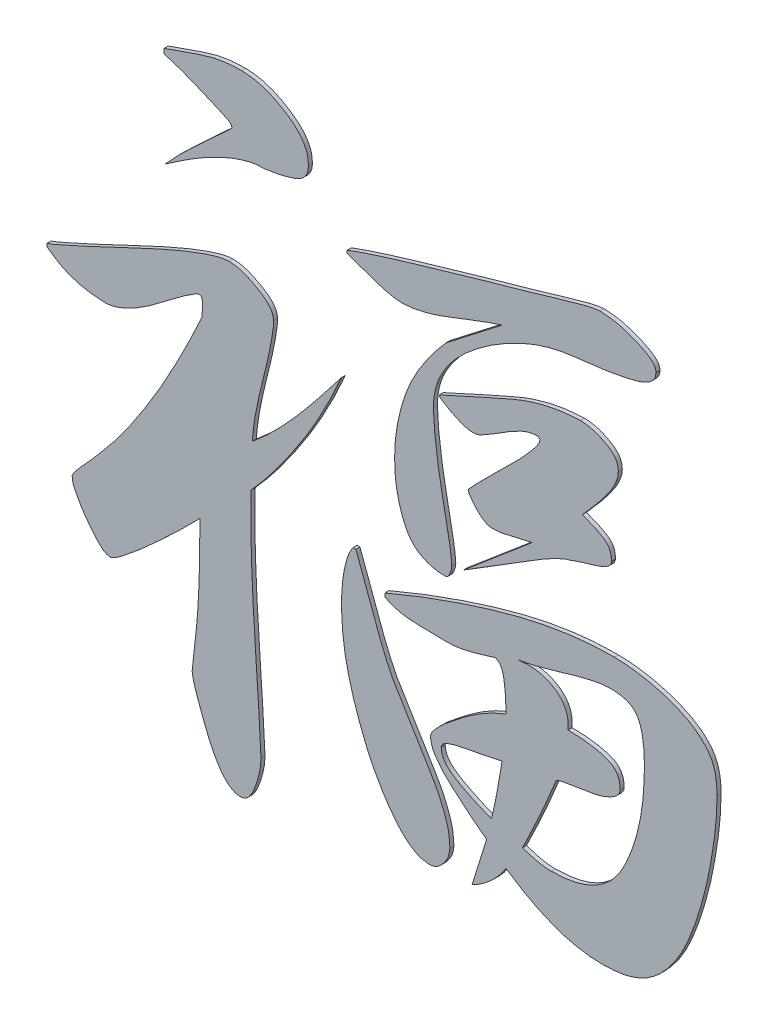
from build123d import *

# Parameters (mm, degrees)
EXTRUDE_1_DEPTH   = 0.2
EXTRUDE_1_2_DEPTH = 0.2
EXTRUDE_1_3_DEPTH = 0.2
EXTRUDE_1_4_DEPTH = 0.2
EXTRUDE_1_5_DEPTH = 0.2
EXTRUDE_1_6_DEPTH = 0.2


with BuildPart() as part:
    # 草图1 → 凸台-拉伸1 (new body)
    with BuildSketch(Plane.XY):
        with BuildLine():
            add(Edge.make_bspline(
                [(11.330654164, 14.322393391), (11.324253861, 14.134498164), (11.310569021, 13.732749056), (11.306668839, 13.094424337), (11.312968434, 12.383659133), (11.327935575, 11.602029184), (11.366081557, 10.75016704), (11.401169595, 9.825114969), (11.459538592, 8.829892344), (11.525426569, 7.795604838), (11.589514472, 6.788982369), (11.652013891, 5.875657707), (11.703295055, 5.086847596), (11.740115676, 4.424244202), (11.775149816, 3.888623471), (11.798802316, 3.479340829), (11.809329113, 3.19455556), (11.814411476, 3.045695139), (11.816253628, 2.991739228)],
                knots=[0, 0, 0, 0, 0.79538843, 1.700663702, 2.700395676, 3.802681245, 5.007971143, 6.307963553, 7.719187998, 9.225639709, 10.692812639, 11.986665706, 13.098828659, 14.037175588, 14.79432957, 15.369822845, 15.771586145, 16, 16, 16, 16], degree=3))
            add(Edge.make_bspline(
                [(11.816253628, 2.991739228), (11.813022279, 2.891044144), (11.80615662, 2.677096978), (11.74524648, 2.345146739), (11.655592594, 1.984804986), (11.534739538, 1.619335745), (11.390447911, 1.286989233), (11.22515831, 1.026689732), (11.025312642, 0.855319883), (10.871556898, 0.831512991), (10.800401875, 0.820495646)],
                knots=[0, 0, 0, 0, 0.946381514, 2.010779821, 3.165157064, 4.437872024, 5.628291403, 6.560163754, 7.333673149, 8, 8, 8, 8], degree=3))
            add(Edge.make_bspline(
                [(10.800401875, 0.820495646), (10.728754998, 0.825742305), (10.580033601, 0.836633086), (10.364558586, 0.936598595), (10.149332792, 1.083115432), (9.942504302, 1.295694337), (9.744093555, 1.567415416), (9.543999762, 1.892890176), (9.341565875, 2.273765443), (9.157420122, 2.700236963), (8.984933788, 3.133720454), (8.831834058, 3.538640192), (8.691683362, 3.896839702), (8.591774428, 4.216423073), (8.494347312, 4.486114912), (8.443675858, 4.719744647), (8.397549873, 4.904514056), (8.391631709, 5.015825089), (8.389149364, 5.062513954)],
                knots=[0, 0, 0, 0, 0.669575808, 1.389875645, 2.194247352, 3.108372334, 4.156562561, 5.349126888, 6.693282995, 8.202782061, 9.708029294, 11.073920326, 12.268019157, 13.317664194, 14.218166094, 14.955426338, 15.561858714, 16, 16, 16, 16], degree=3))
            add(Edge.make_bspline(
                [(8.389149364, 5.062513954), (8.391204608, 5.082965116), (8.396614331, 5.136795772), (8.399250414, 5.241517896), (8.419941206, 5.391750133), (8.441693492, 5.588799438), (8.461501645, 5.833187261), (8.497611136, 6.121101632), (8.535515119, 6.45612431), (8.581884144, 6.837127273), (8.627598774, 7.270431545), (8.665101539, 7.758132803), (8.698605323, 8.301468126), (8.726156746, 8.898781656), (8.747573021, 9.550027356), (8.766416066, 10.257021743), (8.76802901, 11.018095151), (8.772152608, 11.544619551), (8.774279973, 11.816253628)],
                knots=[0, 0, 0, 0, 0.145696367, 0.38349562, 0.74183702, 1.219625554, 1.789275715, 2.47974456, 3.276556324, 4.179711983, 5.200865282, 6.365316083, 7.647262247, 9.060210408, 10.604427396, 12.266930311, 14.074108358, 16, 16, 16, 16], degree=3))
            add(Edge.make_bspline(
                [(8.774279973, 11.816253628), (8.587384844, 11.623597074), (8.198011069, 11.222220054), (7.568863436, 10.615831203), (6.885188185, 9.964899407), (6.272881828, 9.422780712), (5.794741511, 8.984267428), (5.456290527, 8.709997517), (5.16889581, 8.465834856), (4.914882571, 8.272569691), (4.708144867, 8.110917794), (4.532097407, 8.009790395), (4.404485951, 7.929611434), (4.324453244, 7.915007341), (4.292252735, 7.909131503)],
                knots=[0, 0, 0, 0, 1.618357131, 3.371654625, 5.26839297, 7.309714225, 8.302860571, 9.17906056, 9.936045346, 10.57560345, 11.105139972, 11.513040299, 11.804075726, 12, 12, 12, 12], degree=3))
            add(Edge.make_bspline(
                [(4.292252735, 7.909131503), (4.21750946, 7.926826289), (4.037987812, 7.969326398), (3.780627672, 8.192020626), (3.477207831, 8.515302639), (3.153512772, 8.943504377), (2.841046788, 9.389899022), (2.613866689, 9.809147294), (2.445665143, 10.15187044), (2.421593681, 10.371256723), (2.411252512, 10.465505693)],
                knots=[0, 0, 0, 0, 0.555032031, 1.333100069, 2.420344952, 3.816151121, 5.246006348, 6.3967443, 7.311236795, 8, 8, 8, 8], degree=3))
            add(Edge.make_bspline(
                [(2.411252512, 10.465505693), (2.422861432, 10.501555033), (2.455937479, 10.604266536), (2.587466636, 10.771148642), (2.784109915, 11.006738645), (3.051696585, 11.30598946), (3.379438, 11.650756414), (3.721391683, 12.057916548), (4.097903504, 12.496950445), (4.501954485, 12.990769036), (4.939136298, 13.5635118), (5.410315847, 14.238651026), (5.92522693, 15.024504684), (6.48003817, 15.918424678), (7.067156643, 16.919994462), (7.660568175, 18.034433655), (8.277676092, 19.248397684), (8.671180457, 20.103511692), (8.874748828, 20.545880777)],
                knots=[0, 0, 0, 0, 0.150259248, 0.428117494, 0.833824251, 1.380448858, 2.026397406, 2.731488223, 3.500174529, 4.333484975, 5.275952657, 6.373274326, 7.616425856, 9.022873249, 10.569263833, 12.245932144, 14.057939003, 16, 16, 16, 16], degree=3))
            add(Edge.make_bspline(
                [(8.874748828, 20.545880777), (8.886341622, 20.684976653), (8.905907402, 20.919736209), (8.905901753, 21.196401959), (8.877017537, 21.416733513), (8.774216995, 21.447792016), (8.729627149, 21.461263675)],
                knots=[0, 0, 0, 0, 1.659233457, 2.800377112, 3.479662284, 4, 4, 4, 4], degree=3))
            add(Edge.make_bspline(
                [(8.729627149, 21.461263675), (8.708853429, 21.458495574), (8.646532268, 21.45019127), (8.536187121, 21.380656481), (8.371554794, 21.285949383), (8.155724164, 21.141135723), (7.890235607, 20.952692748), (7.573690503, 20.715232724), (7.196872633, 20.446830091), (6.797173521, 20.129571937), (6.382958057, 19.814491232), (5.975667853, 19.533920296), (5.592334809, 19.301658652), (5.236504109, 19.105558379), (4.904528943, 18.958930224), (4.60198011, 18.839423202), (4.319051452, 18.77626234), (4.138068098, 18.765073619), (4.052243804, 18.759767805)],
                knots=[0, 0, 0, 0, 0.182638434, 0.547915302, 1.119430622, 1.862479552, 2.823372968, 3.97998051, 5.3359402, 6.884731349, 8.459494111, 9.904901646, 11.224456431, 12.393913014, 13.468721188, 14.409406643, 15.245723168, 16, 16, 16, 16], degree=3))
            add(Edge.make_bspline(
                [(4.052243804, 18.759767805), (3.807697068, 18.771587599), (3.309773672, 18.795653968), (2.564336666, 18.961409445), (1.819614773, 19.249562009), (1.380238558, 19.564313801), (1.155391829, 19.725385131)],
                knots=[0, 0, 0, 0, 0.943604929, 1.921280884, 2.936234645, 4, 4, 4, 4], degree=3))
            Line((1.155391829, 19.725385131), (1.155391829, 19.87050681))
            add(Edge.make_bspline(
                [(1.155391829, 19.87050681), (1.220684659, 19.89424472), (1.386330399, 19.95446701), (1.679777848, 20.07904119), (2.07306945, 20.254644734), (2.565865269, 20.476622664), (3.161418887, 20.743832118), (3.848987368, 21.069679486), (4.641804494, 21.437334824), (5.497908559, 21.848408264), (6.363909556, 22.252620319), (7.17311202, 22.615951141), (7.894136469, 22.925544195), (8.52883833, 23.176669845), (9.075538102, 23.374681138), (9.534890665, 23.51600964), (9.907458022, 23.609155821), (10.130270536, 23.625515438), (10.225496763, 23.632507256)],
                knots=[0, 0, 0, 0, 0.338665448, 0.85918299, 1.553608017, 2.43868447, 3.494161622, 4.735883398, 6.148027237, 7.75474018, 9.365799953, 10.807152419, 12.07918291, 13.190886292, 14.134803017, 14.912398318, 15.535177797, 16, 16, 16, 16], degree=3))
            add(Edge.make_bspline(
                [(10.225496763, 23.632507256), (10.333961837, 23.627012873), (10.561728455, 23.615475176), (10.908403298, 23.518100147), (11.27424607, 23.370388429), (11.642396654, 23.176307299), (11.982138802, 22.96101868), (12.237800272, 22.716593056), (12.409445864, 22.458616357), (12.431076405, 22.270847489), (12.441393168, 22.181290467)],
                knots=[0, 0, 0, 0, 0.917402559, 1.926460469, 3.029691615, 4.256150376, 5.449355566, 6.418876308, 7.245877491, 8, 8, 8, 8], degree=3))
            add(Edge.make_bspline(
                [(12.441393168, 22.181290467), (12.440899248, 22.114215975), (12.439811623, 21.966516025), (12.405495463, 21.727052624), (12.36923276, 21.447348577), (12.311390974, 21.12743815), (12.237393674, 20.767171484), (12.157072076, 20.36365987), (12.046800815, 19.924480514), (11.896736199, 19.305255561), (11.714914113, 18.563819166), (11.544558526, 17.749254767), (11.434429612, 17.0559736), (11.397495576, 16.633405609), (11.380888591, 16.443402545)],
                knots=[0, 0, 0, 0, 0.412783449, 0.908960966, 1.487639277, 2.150939069, 2.910709372, 3.75367677, 4.684977723, 5.699653309, 7.679060907, 9.387443828, 10.825292763, 12, 12, 12, 12], degree=3))
            add(Edge.make_bspline(
                [(11.380888591, 16.443402545), (11.559170681, 16.594245658), (11.925368452, 16.904082792), (12.457722836, 17.413106913), (12.996155702, 17.967642602), (13.535320899, 18.572869184), (14.088728205, 19.219930904), (14.64988278, 19.914008483), (15.232970915, 20.645103052), (15.620096398, 21.151704036), (15.818263005, 21.411029248)],
                knots=[0, 0, 0, 0, 0.839469166, 1.724299603, 2.64676325, 3.617812911, 4.637941935, 5.707743082, 6.826611019, 8, 8, 8, 8], degree=3))
            add(Edge.make_bspline(
                [(15.818263005, 21.411029248), (15.670984658, 21.076367339), (15.376534832, 20.407286358), (14.873927068, 19.434215585), (14.348823846, 18.475575296), (13.772174323, 17.558395239), (13.184707087, 16.672468917), (12.582608281, 15.835657118), (11.970718743, 15.051159371), (11.541367867, 14.562308211), (11.330654164, 14.322393391)],
                knots=[0, 0, 0, 0, 1.041371311, 2.081986987, 3.118816234, 4.154276263, 5.167133537, 6.146815387, 7.090507525, 8, 8, 8, 8], degree=3))
        make_face()
    extrude(amount=EXTRUDE_1_DEPTH)


with BuildPart() as body_2:
    # 草图1 → Extrude 1 2 (new body)
    with BuildSketch(Plane.XY):
        with BuildLine():
            add(Edge.make_bspline(
                [(21.316141996, 16.058271936), (21.312308921, 15.992062594), (21.304069452, 15.849740873), (21.21993503, 15.666069905), (21.152112354, 15.492773477), (21.059970192, 15.449232582), (21.025898638, 15.433132396)],
                knots=[0, 0, 0, 0, 1.091800076, 2.346902458, 3.38873148, 4, 4, 4, 4], degree=3))
            add(Edge.make_bspline(
                [(21.025898638, 15.433132396), (20.910289326, 15.43569022), (20.685061919, 15.440673316), (20.362733523, 15.497817408), (20.067504412, 15.586342534), (19.801881974, 15.712200845), (19.55762366, 15.865583171), (19.351286046, 16.068510505), (19.16178339, 16.296322967), (18.965657869, 16.663985185), (18.766122079, 17.169449432), (18.594530329, 17.827412598), (18.485507279, 18.540320818), (18.474967401, 19.03471001), (18.469524447, 19.290020094)],
                knots=[0, 0, 0, 0, 0.793196158, 1.545286547, 2.240514064, 2.903644977, 3.559347005, 4.210174787, 4.88271922, 5.586467429, 7.060049272, 8.606727277, 10.247662454, 12, 12, 12, 12], degree=3))
            add(Edge.make_bspline(
                [(18.469524447, 19.290020094), (18.475481249, 19.541586362), (18.487447626, 20.046947651), (18.601251807, 20.806557553), (18.773453275, 21.569971722), (19.014533673, 22.346318495), (19.349021055, 23.132377696), (19.806600355, 23.920699991), (20.357427394, 24.731068053), (20.797334844, 25.245975666), (21.025898638, 25.513507479)],
                knots=[0, 0, 0, 0, 0.876292567, 1.760348648, 2.671206051, 3.602335618, 4.590048782, 5.6413031, 6.774486057, 8, 8, 8, 8], degree=3))
            Line((21.025898638, 25.513507479), (23.822281759, 27.679169457))
            add(Edge.make_bspline(
                [(23.822281759, 27.679169457), (23.771963157, 27.664556438), (23.657790655, 27.631399615), (23.468384933, 27.568730516), (23.238267127, 27.492175362), (22.973093792, 27.387861098), (22.663208696, 27.28029317), (22.321608306, 27.143159098), (21.936313484, 26.9995489), (21.397156736, 26.782506998), (20.745752107, 26.534662941), (20.023296326, 26.313550384), (19.405031364, 26.174056787), (19.024476874, 26.14957291), (18.854655057, 26.138647019)],
                knots=[0, 0, 0, 0, 0.361274893, 0.819729812, 1.37554873, 2.033227569, 2.784040037, 3.63696794, 4.570951266, 5.619187945, 7.644787611, 9.373739958, 10.828035765, 12, 12, 12, 12], degree=3))
            add(Edge.make_bspline(
                [(18.854655057, 26.138647019), (18.750205853, 26.143758828), (18.520955584, 26.154978476), (18.153405081, 26.22815796), (17.734121735, 26.340403741), (17.291624732, 26.492066769), (16.875192332, 26.645106442), (16.531631703, 26.769676913), (16.288219772, 26.854640639), (16.156961265, 26.894276435), (16.108506363, 26.908908238)],
                knots=[0, 0, 0, 0, 0.875487053, 1.921562192, 3.131979567, 4.512728305, 5.839682395, 6.850888363, 7.575798223, 8, 8, 8, 8], degree=3))
            Line((16.108506363, 26.908908238), (16.108506363, 27.054029917))
            add(Edge.make_bspline(
                [(16.108506363, 27.054029917), (16.190264219, 27.085931089), (16.378937857, 27.159549827), (16.703681995, 27.277722663), (17.109586957, 27.407220242), (17.592471773, 27.566088767), (18.155470953, 27.745393458), (18.80110883, 27.936429506), (19.523006518, 28.158449505), (20.300435518, 28.381968918), (21.078225499, 28.608636075), (21.80080293, 28.822909878), (22.44536808, 29.001630987), (23.00150596, 29.17685579), (23.484886277, 29.304727837), (23.882918711, 29.425147053), (24.20372263, 29.513550315), (24.538264688, 29.607836729), (24.945845389, 29.716200691), (25.477814984, 29.877652573), (26.101824341, 30.05935893), (26.778065311, 30.261659953), (27.427997372, 30.452788105), (27.975662882, 30.600467165), (28.38145136, 30.693383664), (28.607352146, 30.713382019), (28.69502121, 30.721143112)],
                knots=[0, 0, 0, 0, 0.481687843, 1.111597125, 1.89630973, 2.819895706, 3.901812476, 5.139122402, 6.515325444, 8.04708972, 9.578853997, 10.961935262, 12.183681989, 13.249821225, 14.161589177, 14.927471315, 15.532038665, 15.98792264, 16.835191234, 17.846568169, 19.03889796, 20.402388065, 21.720931766, 22.756305719, 23.51733894, 24, 24, 24, 24], degree=3))
            add(Edge.make_bspline(
                [(28.69502121, 30.721143112), (28.842195097, 30.714478584), (29.141894709, 30.700907179), (29.598570557, 30.629650942), (30.060903061, 30.488641423), (30.517341209, 30.319358901), (30.924298251, 30.126850711), (31.234338408, 29.925227271), (31.444895985, 29.70854012), (31.476987553, 29.540688084), (31.491404331, 29.465282429)],
                knots=[0, 0, 0, 0, 1.094463164, 2.228725434, 3.423320894, 4.679080779, 5.847791615, 6.752859942, 7.439736242, 8, 8, 8, 8], degree=3))
            add(Edge.make_bspline(
                [(31.491404331, 29.465282429), (31.477610228, 29.37045991), (31.44886711, 29.172875864), (31.215873606, 28.923101163), (30.869514837, 28.7300485), (30.397432482, 28.575071265), (29.811688802, 28.45194638), (29.118521191, 28.319087366), (28.314621053, 28.213902742), (27.742516587, 28.148966612), (27.439160527, 28.114534494)],
                knots=[0, 0, 0, 0, 0.500525511, 1.042957486, 1.737186929, 2.60949938, 3.678135963, 4.929400572, 6.371827178, 8, 8, 8, 8], degree=3))
            add(Edge.make_bspline(
                [(27.439160527, 28.114534494), (27.241400647, 28.089852387), (26.845080149, 28.040388234), (26.254663285, 27.906586306), (25.663446959, 27.737161366), (25.075940034, 27.509631828), (24.488688423, 27.241482075), (23.902075623, 26.927391277), (23.314019573, 26.569357734), (22.739010951, 26.169798208), (22.200087538, 25.743139634), (21.72088373, 25.301977506), (21.315331476, 24.848819511), (20.983946263, 24.384489047), (20.72232642, 23.911655013), (20.534268906, 23.42812493), (20.426090774, 22.930252155), (20.409210606, 22.594822722), (20.400759098, 22.426881)],
                knots=[0, 0, 0, 0, 0.983104393, 1.970189414, 2.984369065, 4.016189379, 5.076387827, 6.169174378, 7.298394575, 8.472752213, 9.622949055, 10.688582114, 11.68379248, 12.618934901, 13.498403633, 14.344294437, 15.171026707, 16, 16, 16, 16], degree=3))
            add(Edge.make_bspline(
                [(20.400759098, 22.426881), (20.411922584, 22.149364076), (20.435206326, 21.570545569), (20.547627065, 20.670861393), (20.679031112, 19.698945891), (20.845904182, 18.863289741), (20.97828682, 18.196181551), (21.067104967, 17.738389137), (21.146973395, 17.331587593), (21.208418647, 16.976149668), (21.253179715, 16.672521204), (21.285897451, 16.421317711), (21.312316393, 16.222539193), (21.3150142, 16.106698257), (21.316141996, 16.058271936)],
                knots=[0, 0, 0, 0, 1.551523487, 3.236020687, 5.063840041, 7.031798186, 7.99634307, 8.865052861, 9.637934777, 10.31316023, 10.880776894, 11.352824719, 11.729453862, 12, 12, 12, 12], degree=3))
        make_face()
    extrude(amount=EXTRUDE_1_2_DEPTH)


with BuildPart() as body_3:
    # 草图1 → Extrude 1 3 (new body)
    with BuildSketch(Plane.XY):
        with BuildLine():
            Line((16.398749721, 14.372627819), (16.5438714, 14.372627819))
            add(Edge.make_bspline(
                [(16.5438714, 14.372627819), (16.657295446, 14.060034165), (16.872107495, 13.468017874), (17.176720502, 12.631748506), (17.453875024, 11.900742287), (17.686563914, 11.260983533), (17.907737271, 10.701639358), (18.124370739, 10.208699691), (18.333343584, 9.767163851), (18.636724076, 9.251386365), (19.040585631, 8.607948767), (19.445906993, 7.947232803), (19.774558829, 7.407269101), (20.003268524, 7.027647944), (20.2092083, 6.684154992), (20.44871288, 6.272216056), (20.728917358, 5.772576852), (20.982730041, 5.141856689), (21.187938343, 4.488691301), (21.210181797, 4.03706008), (21.221254744, 3.812234874)],
                knots=[0, 0, 0, 0, 1.543544745, 2.923295538, 4.131177246, 5.17228436, 6.083178246, 6.922347909, 7.6716511, 8.348635593, 9.697997211, 11.198419017, 11.946377273, 12.632118598, 13.255654752, 13.80518508, 14.844571472, 15.909476775, 16.9593228, 18, 18, 18, 18], degree=3))
            add(Edge.make_bspline(
                [(21.221254744, 3.812234874), (21.204596504, 3.677038467), (21.168633783, 3.385169056), (20.95516126, 3.067918193), (20.753338126, 2.838000864), (20.584256164, 2.701767296), (20.397330291, 2.625401335), (20.269270872, 2.612862293), (20.205402992, 2.606608618)],
                knots=[0, 0, 0, 0, 1.41839124, 3.062100729, 3.908536818, 4.64945605, 5.326434705, 6, 6, 6, 6], degree=3))
            add(Edge.make_bspline(
                [(20.205402992, 2.606608618), (20.057698264, 2.621655783), (19.747101523, 2.653297292), (19.301811821, 2.899663216), (18.854523784, 3.265486044), (18.427569795, 3.772565565), (18.006326853, 4.358006125), (17.616024933, 5.003776402), (17.258540913, 5.689197794), (16.945326605, 6.409341357), (16.674762766, 7.135052965), (16.428861783, 7.840103976), (16.235841493, 8.521305032), (16.024725288, 9.3889351), (15.859277532, 10.46860985), (15.831927893, 11.333758849), (15.818263005, 11.766019201)],
                knots=[0, 0, 0, 0, 0.575801795, 1.210808644, 1.951139853, 2.833420229, 3.793326207, 4.773646082, 5.783275449, 6.816882703, 7.844702708, 8.814144911, 9.738338796, 10.614346814, 12.308402783, 14, 14, 14, 14], degree=3))
            add(Edge.make_bspline(
                [(15.818263005, 11.766019201), (15.82757853, 11.998844452), (15.846964405, 12.483360499), (15.931826616, 13.08771556), (16.039464078, 13.563133018), (16.136874937, 13.87987683), (16.25296633, 14.14945203), (16.352086322, 14.301192104), (16.398749721, 14.372627819)],
                knots=[0, 0, 0, 0, 1.551084558, 3.227851587, 4.054318665, 4.794881752, 5.432658218, 6, 6, 6, 6], degree=3))
        make_face()
    extrude(amount=EXTRUDE_1_3_DEPTH)


with BuildPart() as body_4:
    # 草图1 → Extrude 1 4 (new body)
    with BuildSketch(Plane.XY):
        with BuildLine():
            add(Edge.make_bspline(
                [(29.269926323, 20.205402992), (29.256298068, 20.148446777), (29.2241113, 20.013929452), (29.017398813, 19.863013501), (28.728375513, 19.721098037), (28.353056352, 19.599116328), (27.971730331, 19.492018775), (27.65147581, 19.386514586), (27.416578455, 19.317070541), (27.295560184, 19.26112972), (27.249386024, 19.239785666)],
                knots=[0, 0, 0, 0, 0.592093551, 1.398387193, 2.503314584, 3.974428174, 5.464539272, 6.618290104, 7.472812708, 8, 8, 8, 8], degree=3))
            add(Edge.make_bspline(
                [(27.249386024, 19.239785666), (27.193194296, 19.228103923), (27.06313374, 19.20106553), (26.85273593, 19.1186064), (26.600549103, 18.997123294), (26.301334424, 18.849050607), (25.958962679, 18.66265294), (25.573893184, 18.438977343), (25.145986772, 18.175306694), (24.685610344, 17.890069792), (24.226631586, 17.592995295), (23.782414327, 17.323932537), (23.383297683, 17.063574268), (23.015839994, 16.836153962), (22.682361265, 16.635244697), (22.39076284, 16.450933078), (22.13149823, 16.293824748), (21.971085629, 16.197752134), (21.896628712, 16.153159187)],
                knots=[0, 0, 0, 0, 0.444176918, 1.028085426, 1.744095967, 2.614601722, 3.614591171, 4.7645587, 6.065272424, 7.509580795, 8.961569611, 10.301956005, 11.533881122, 12.654178883, 13.650732111, 14.550942037, 15.327407027, 16, 16, 16, 16], degree=3))
            Line((21.896628712, 16.153159187), (25.318151373, 19.050011163))
            add(Edge.make_bspline(
                [(25.318151373, 19.050011163), (25.109502643, 19.004441408), (24.72136804, 18.919671188), (24.190525437, 18.789398439), (23.742595319, 18.68346251), (23.467378873, 18.670687944), (23.342263898, 18.664880554)],
                knots=[0, 0, 0, 0, 1.27061078, 2.363628136, 3.256095966, 4, 4, 4, 4], degree=3))
            add(Edge.make_bspline(
                [(23.342263898, 18.664880554), (23.276071359, 18.670099331), (23.13782922, 18.68099867), (22.939921835, 18.783526833), (22.734299798, 18.924237675), (22.542846384, 19.116987977), (22.379508975, 19.317603587), (22.24441427, 19.482890693), (22.166930896, 19.6160603), (22.144986883, 19.695253692), (22.136637642, 19.725385131)],
                knots=[0, 0, 0, 0, 0.940205355, 1.963604955, 3.129156264, 4.501984871, 5.823098861, 6.828371421, 7.554219698, 8, 8, 8, 8], degree=3))
            add(Edge.make_bspline(
                [(22.136637642, 19.725385131), (22.145478574, 19.742441532), (22.174439659, 19.798314814), (22.266080729, 19.89417289), (22.405128094, 20.046278804), (22.598027352, 20.251974994), (22.853548914, 20.500606135), (23.152358724, 20.812067836), (23.516427193, 21.166197284), (23.918575131, 21.556564969), (24.319873465, 21.951625819), (24.684576326, 22.320079902), (24.993298572, 22.648276398), (25.241018817, 22.937764651), (25.442546291, 23.177599947), (25.582159967, 23.378520344), (25.676801951, 23.53776549), (25.695743111, 23.637474404), (25.703281983, 23.67716008)],
                knots=[0, 0, 0, 0, 0.171775479, 0.562701345, 1.176629522, 2.026383528, 3.088166475, 4.374157717, 5.896092335, 7.642294824, 9.40017507, 10.945704166, 12.29145688, 13.438798879, 14.363838141, 15.095098308, 15.63983526, 16, 16, 16, 16], degree=3))
            add(Edge.make_bspline(
                [(25.703281983, 23.67716008), (25.701888663, 23.693642231), (25.699041852, 23.727318316), (25.65334726, 23.746831284), (25.628102627, 23.768263437), (25.612166647, 23.775836462), (25.608394731, 23.777628935)],
                knots=[0, 0, 0, 0, 1.254381369, 2.562933408, 3.659858094, 4, 4, 4, 4], degree=3))
            add(Edge.make_bspline(
                [(25.608394731, 23.777628935), (25.499774766, 23.772752256), (25.250683116, 23.761568862), (24.846204898, 23.623836329), (24.377653544, 23.385458188), (23.869791239, 23.083115924), (23.396830472, 22.764188384), (22.992660397, 22.546062334), (22.728156415, 22.377118197), (22.574622265, 22.339397475), (22.521768252, 22.326412146)],
                knots=[0, 0, 0, 0, 0.754123942, 1.729387206, 2.940230979, 4.415405646, 5.842121033, 6.904198509, 7.622771175, 8, 8, 8, 8], degree=3))
            add(Edge.make_bspline(
                [(22.521768252, 22.326412146), (22.405660922, 22.322029884), (22.145520512, 22.312211354), (21.726895059, 22.453888409), (21.245010812, 22.678667644), (20.915693064, 22.887576039), (20.73565528, 23.001786113)],
                knots=[0, 0, 0, 0, 0.712394433, 1.596131619, 2.685806822, 4, 4, 4, 4], degree=3))
            Line((20.73565528, 23.001786113), (20.691002456, 23.102254968))
            add(Edge.make_bspline(
                [(20.691002456, 23.102254968), (21.014561716, 23.251474132), (21.645877727, 23.542624655), (22.575850076, 23.963852962), (23.467541458, 24.354833332), (24.31690498, 24.74183248), (25.157134543, 25.066125451), (26.003750345, 25.30957663), (26.862664668, 25.463924217), (27.440429018, 25.49697619), (27.729403885, 25.513507479)],
                knots=[0, 0, 0, 0, 1.140686552, 2.22566241, 3.268284224, 4.257690817, 5.213465501, 6.148620934, 7.074013446, 8, 8, 8, 8], degree=3))
            add(Edge.make_bspline(
                [(27.729403885, 25.513507479), (27.828298091, 25.508628275), (28.029730104, 25.4986901), (28.335689881, 25.434000293), (28.648476118, 25.326970482), (28.956321617, 25.180650018), (29.238059111, 25.007499302), (29.455879342, 24.792071337), (29.589851885, 24.534968582), (29.603539314, 24.350277015), (29.610404108, 24.257646796)],
                knots=[0, 0, 0, 0, 0.959961295, 1.955290833, 3.023342624, 4.162482058, 5.25961102, 6.217531289, 7.106020544, 8, 8, 8, 8], degree=3))
            add(Edge.make_bspline(
                [(29.610404108, 24.257646796), (29.602915921, 24.17127326), (29.586545269, 23.9824437), (29.473321034, 23.691421985), (29.311859774, 23.363480972), (28.983184131, 22.883724402), (28.493610329, 22.249471577), (28.052843793, 21.75981851), (27.824291136, 21.505916499)],
                knots=[0, 0, 0, 0, 0.466413254, 1.019671231, 1.671648944, 2.441308307, 4.154695566, 6, 6, 6, 6], degree=3))
            add(Edge.make_bspline(
                [(27.824291136, 21.505916499), (27.945654107, 21.460558887), (28.169996974, 21.376714064), (28.47708697, 21.243111694), (28.724301936, 21.108213526), (28.932117168, 20.988587716), (29.08729293, 20.841306878), (29.197984565, 20.661677924), (29.257250855, 20.44339743), (29.265548528, 20.287600411), (29.269926323, 20.205402992)],
                knots=[0, 0, 0, 0, 1.476851904, 2.7300023, 3.811526531, 4.688198478, 5.453098593, 6.224147286, 7.063072503, 8, 8, 8, 8], degree=3))
        make_face()
    extrude(amount=EXTRUDE_1_4_DEPTH)


with BuildPart() as body_5:
    # 草图1 → Extrude 1 5 (new body)
    with BuildSketch(Plane.XY):
        with BuildLine():
            add(Edge.make_bspline(
                [(14.177271712, 29.755525787), (14.172972811, 29.657256747), (14.164779184, 29.469957751), (14.042322052, 29.218088513), (13.856098237, 29.010124289), (13.586255247, 28.871027569), (13.261224434, 28.765678448), (12.884158346, 28.657397835), (12.443307054, 28.570281242), (12.129050462, 28.524234085), (11.961375307, 28.499665104)],
                knots=[0, 0, 0, 0, 0.834599689, 1.590731771, 2.346863853, 3.189345879, 4.152486875, 5.278220189, 6.54776363, 8, 8, 8, 8], degree=3))
            add(Edge.make_bspline(
                [(11.961375307, 28.499665104), (11.836354208, 28.500039272), (11.561353246, 28.500862307), (11.11574751, 28.404007968), (10.603187255, 28.246092238), (10.019720552, 28.015062529), (9.37208361, 27.696037729), (8.648376617, 27.301412671), (7.865797385, 26.798069818), (7.3239784, 26.428384573), (7.038401429, 26.233534271)],
                knots=[0, 0, 0, 0, 0.544945338, 1.19868161, 1.98050497, 2.889345355, 3.936556129, 5.133667075, 6.489239581, 8, 8, 8, 8], degree=3))
            add(Edge.make_bspline(
                [(7.038401429, 26.233534271), (7.158543698, 26.366369172), (7.421668436, 26.657292164), (7.871185057, 27.11628978), (8.413341012, 27.633046013), (8.914788058, 28.091327107), (9.323419569, 28.464001869), (9.597750148, 28.71428678), (9.827286853, 28.931507036), (10.024122502, 29.102621), (10.16526706, 29.252251711), (10.274047765, 29.351269767), (10.339967311, 29.416967408), (10.363419059, 29.453934125), (10.370618442, 29.465282429)],
                knots=[0, 0, 0, 0, 1.38800694, 3.039887342, 4.977559568, 7.191997082, 8.304531437, 9.263824259, 10.069890069, 10.753707579, 11.283900391, 11.661290728, 11.896020635, 12, 12, 12, 12], degree=3))
            add(Edge.make_bspline(
                [(10.370618442, 29.465282429), (10.354739964, 29.515498188), (10.315804431, 29.638631985), (10.087649657, 29.744284277), (9.799441872, 29.884833803), (9.398366758, 30.051215584), (8.920931116, 30.257046682), (8.363681006, 30.487245551), (7.720623461, 30.744182572), (7.248194001, 30.885201028), (6.993748605, 30.961152043)],
                knots=[0, 0, 0, 0, 0.325886067, 0.799103507, 1.498295627, 2.433609387, 3.561628751, 4.840141759, 6.298134529, 8, 8, 8, 8], degree=3))
            Line((6.993748605, 30.961152043), (6.993748605, 31.201160973))
            add(Edge.make_bspline(
                [(6.993748605, 31.201160973), (7.18706661, 31.270510521), (7.556509618, 31.40304192), (8.088250337, 31.584798678), (8.567456304, 31.756500155), (9.013753952, 31.899145524), (9.446902358, 32.024596101), (9.895529044, 32.105951302), (10.365668267, 32.15777555), (10.686765376, 32.163736266), (10.850636303, 32.166778299)],
                knots=[0, 0, 0, 0, 1.23212255, 2.354664589, 3.37132406, 4.285584726, 5.165683818, 6.074202957, 7.01717537, 8, 8, 8, 8], degree=3))
            add(Edge.make_bspline(
                [(10.850636303, 32.166778299), (11.035546241, 32.15773989), (11.4119137, 32.139343026), (11.974135398, 32.000027954), (12.531803139, 31.765127119), (13.065265466, 31.455332869), (13.548200728, 31.101156076), (13.90362633, 30.685624493), (14.141495048, 30.236017833), (14.165435028, 29.914496246), (14.177271712, 29.755525787)],
                knots=[0, 0, 0, 0, 0.992291029, 2.019718661, 3.090249769, 4.231539149, 5.32859354, 6.285448731, 7.15227153, 8, 8, 8, 8], degree=3))
        make_face()
    extrude(amount=EXTRUDE_1_5_DEPTH)


with BuildPart() as body_6:
    # 草图1 → Extrude 1 6 (new body)
    with BuildSketch(Plane.XY):
        with BuildLine():
            add(Edge.make_bspline(
                [(24.017637866, 4.342487162), (23.909049279, 4.180374383), (23.684493981, 3.845133962), (23.255083719, 3.420395308), (22.8052202, 3.053090161), (22.478048268, 2.87768096), (22.326412146, 2.796383121)],
                knots=[0, 0, 0, 0, 1.007289292, 2.083019526, 3.111526822, 4, 4, 4, 4], degree=3))
            add(Edge.make_bspline(
                [(22.326412146, 2.796383121), (22.380442162, 2.963807174), (22.502238191, 3.341219322), (22.691652124, 3.934262082), (22.879569853, 4.538958646), (22.998316512, 4.93406066), (23.05202054, 5.112748381)],
                knots=[0, 0, 0, 0, 0.869697865, 1.960498105, 3.077620629, 4, 4, 4, 4], degree=3))
            add(Edge.make_bspline(
                [(23.05202054, 5.112748381), (22.93791851, 5.195671217), (22.685586701, 5.379051556), (22.287527881, 5.698190558), (21.828559437, 6.078453061), (21.340451165, 6.500814787), (20.878000372, 6.931761479), (20.541908997, 7.365722751), (20.303629962, 7.758620913), (20.270560699, 8.027708398), (20.255637419, 8.149140433)],
                knots=[0, 0, 0, 0, 0.801304197, 1.772050303, 2.898143333, 4.186934215, 5.442789691, 6.474691254, 7.311668674, 8, 8, 8, 8], degree=3))
            add(Edge.make_bspline(
                [(20.255637419, 8.149140433), (20.261479736, 8.184964866), (20.274993392, 8.267829083), (20.343506965, 8.399380229), (20.456771077, 8.54584885), (20.612020873, 8.713587619), (20.799145466, 8.910068712), (21.035482793, 9.12104778), (21.318407996, 9.349126548), (21.734120251, 9.681605288), (22.264767218, 10.069955046), (22.882540401, 10.470318109), (23.45941372, 10.778762281), (23.839431832, 10.926484835), (24.017637866, 10.995757982)],
                knots=[0, 0, 0, 0, 0.270562128, 0.625827607, 1.094040429, 1.656455401, 2.336403914, 3.125651952, 4.026676068, 5.058217344, 7.112339157, 8.948438634, 10.568998086, 12, 12, 12, 12], degree=3))
            add(Edge.make_bspline(
                [(24.017637866, 10.995757982), (24.014912098, 11.252806797), (24.009781413, 11.736647339), (23.943633237, 12.312054408), (23.869022714, 12.70756098), (23.777905891, 12.92851762), (23.651355186, 13.091467986), (23.540233082, 13.142657045), (23.487385577, 13.167001563)],
                knots=[0, 0, 0, 0, 1.979086077, 3.72521491, 4.459114671, 5.068992047, 5.55723078, 6, 6, 6, 6], degree=3))
            add(Edge.make_bspline(
                [(23.487385577, 13.167001563), (23.247602498, 13.093617706), (22.806669845, 12.958673496), (22.184909913, 12.781084215), (21.620251102, 12.662012053), (21.255290829, 12.645067365), (21.076133065, 12.636749274)],
                knots=[0, 0, 0, 0, 1.214387812, 2.233115199, 3.132642225, 4, 4, 4, 4], degree=3))
            add(Edge.make_bspline(
                [(21.076133065, 12.636749274), (20.899391037, 12.638986475), (20.562649009, 12.643248957), (20.084275998, 12.6434769), (19.656518318, 12.666001002), (19.164329528, 12.67789236), (18.59713457, 12.764602405), (18.189635922, 12.937142557), (17.989506586, 13.021879884)],
                knots=[0, 0, 0, 0, 1.013819552, 1.93160424, 2.743246553, 3.469593554, 4.757275478, 6, 6, 6, 6], degree=3))
            Line((17.989506586, 13.021879884), (17.989506586, 13.211654387))
            add(Edge.make_bspline(
                [(17.989506586, 13.211654387), (18.497775703, 13.423879251), (19.500434462, 13.842533682), (21.011505806, 14.396043788), (22.492692108, 14.901895651), (23.947627712, 15.337434186), (25.367769455, 15.701820345), (26.753201687, 15.956791032), (28.097393818, 16.124293735), (28.981074721, 16.143652266), (29.415048002, 16.153159187)],
                knots=[0, 0, 0, 0, 1.113283556, 2.196166305, 3.252306428, 4.276827168, 5.265628804, 6.214267863, 7.123031818, 8, 8, 8, 8], degree=3))
            add(Edge.make_bspline(
                [(29.415048002, 16.153159187), (29.696508373, 16.142261277), (30.279581629, 16.119685168), (31.158922464, 15.970399475), (32.034472131, 15.737322245), (32.731633824, 15.463122241), (33.235119005, 15.18505052), (33.571542757, 14.96156242), (33.855520721, 14.70289604), (34.101896464, 14.42349863), (34.300765795, 14.091396234), (34.437676753, 13.697148247), (34.512836244, 13.234962093), (34.522589676, 12.906813286), (34.527796383, 12.731636526)],
                knots=[0, 0, 0, 0, 1.467154187, 3.039356365, 4.636903437, 6.185837451, 6.928178456, 7.633012464, 8.285448677, 8.925070792, 9.568797789, 10.289730793, 11.087001351, 12, 12, 12, 12], degree=3))
            add(Edge.make_bspline(
                [(34.527796383, 12.731636526), (34.522612376, 12.497106769), (34.511735506, 12.005026102), (34.448075849, 11.237460994), (34.340848352, 10.408864824), (34.189327476, 9.536537585), (34.013838993, 8.646052968), (33.786096402, 7.772153378), (33.532169281, 6.923211835), (33.239648824, 6.109343026), (32.913355994, 5.345369292), (32.527472554, 4.659151166), (32.089816486, 4.057313702), (31.606646078, 3.534607808), (31.047570098, 3.113774582), (30.402925482, 2.812648561), (29.669417261, 2.64106318), (29.153625035, 2.61841354), (28.884795713, 2.606608618)],
                knots=[0, 0, 0, 0, 0.881063032, 1.848610126, 2.891477428, 4.01864342, 5.174120544, 6.299681967, 7.409598299, 8.501724298, 9.547024383, 10.526612972, 11.452047753, 12.33701072, 13.191076328, 14.06339175, 14.990645737, 16, 16, 16, 16], degree=3))
            add(Edge.make_bspline(
                [(28.884795713, 2.606608618), (28.668520696, 2.610685472), (28.237548626, 2.618809436), (27.598691981, 2.724456691), (26.964040618, 2.861760399), (26.140578358, 3.154833505), (25.133188076, 3.613643994), (24.391559291, 4.098186122), (24.017637866, 4.342487162)],
                knots=[0, 0, 0, 0, 0.740947305, 1.476488578, 2.216445899, 2.965157179, 4.469864199, 6, 6, 6, 6], degree=3))
        make_face()
        with BuildLine():
            add(Edge.make_bspline(
                [(24.642777406, 13.647019424), (24.819348725, 13.664253806), (25.158161865, 13.697323929), (25.649440681, 13.648322896), (26.090995119, 13.511329514), (26.476204825, 13.300928697), (26.794912429, 13.026185074), (27.010500056, 12.682017322), (27.122340449, 12.284341595), (27.110486516, 12.006661643), (27.104264345, 11.860906452)],
                knots=[0, 0, 0, 0, 1.198470431, 2.299679998, 3.315140204, 4.30690834, 5.252110598, 6.128929953, 7.017868706, 8, 8, 8, 8], degree=3))
            add(Edge.make_bspline(
                [(27.104264345, 11.860906452), (27.275548284, 11.85756795), (27.605698609, 11.851132977), (28.082972022, 11.805511344), (28.524317605, 11.735447056), (28.921881775, 11.634642829), (29.26966911, 11.49386105), (29.529974055, 11.264367498), (29.679130701, 10.9543288), (29.69624703, 10.729452712), (29.70529136, 10.610627372)],
                knots=[0, 0, 0, 0, 1.274808068, 2.457196508, 3.566001608, 4.597282511, 5.508495691, 6.332031197, 7.118639238, 8, 8, 8, 8], degree=3))
            add(Edge.make_bspline(
                [(29.70529136, 10.610627372), (29.700722824, 10.563407886), (29.691312406, 10.466143654), (29.618505116, 10.326385789), (29.496308308, 10.205354964), (29.283695493, 10.0582838), (28.974707264, 9.907521286), (28.552628772, 9.774949789), (28.043021599, 9.686507851), (27.566998636, 9.605262355), (27.160332142, 9.557574069), (26.899664877, 9.502125773), (26.689922686, 9.464914818), (26.573669711, 9.42299274), (26.523777629, 9.405001116)],
                knots=[0, 0, 0, 0, 0.474589421, 0.977574713, 1.547686348, 2.192694034, 3.575903588, 4.9927447, 6.636022446, 8.780930214, 9.85987633, 10.756905941, 11.466503533, 12, 12, 12, 12], degree=3))
            add(Edge.make_bspline(
                [(26.523777629, 9.405001116), (26.393378206, 9.082416088), (26.131216118, 8.433873611), (25.709152002, 7.478711707), (25.276481015, 6.547763652), (24.982177986, 5.940312979), (24.838133512, 5.64300067)],
                knots=[0, 0, 0, 0, 1.012537543, 2.03566052, 3.038568345, 4, 4, 4, 4], degree=3))
            add(Edge.make_bspline(
                [(24.838133512, 5.64300067), (24.942283593, 5.611231076), (25.16474885, 5.543371013), (25.5147741, 5.439880193), (25.89375258, 5.364800645), (26.155055172, 5.356731865), (26.283768698, 5.352757312)],
                knots=[0, 0, 0, 0, 0.882310361, 1.884620737, 2.957997617, 4, 4, 4, 4], degree=3))
            add(Edge.make_bspline(
                [(26.283768698, 5.352757312), (26.492541873, 5.359088111), (26.895630696, 5.3713113), (27.474895351, 5.467590292), (28.007355922, 5.622718303), (28.490164981, 5.845369734), (28.920582979, 6.136605942), (29.306465825, 6.483281169), (29.630701054, 6.905231476), (30.002532937, 7.548689897), (30.370399243, 8.448888879), (30.686606719, 9.615129943), (30.880190826, 10.877709054), (30.900449435, 11.750426928), (30.910917616, 12.201384238)],
                knots=[0, 0, 0, 0, 0.802912181, 1.550222756, 2.25234909, 2.931322004, 3.58651913, 4.245265372, 4.918325491, 5.624273197, 7.100055136, 8.643939973, 10.265831551, 12, 12, 12, 12], degree=3))
            add(Edge.make_bspline(
                [(30.910917616, 12.201384238), (30.909457434, 12.404410567), (30.906743199, 12.781802667), (30.843630797, 13.302731208), (30.754481061, 13.73977784), (30.619955294, 14.099310752), (30.407425469, 14.388219536), (30.091370021, 14.58143951), (29.686079845, 14.688879896), (29.38786711, 14.700945506), (29.225273499, 14.707524001)],
                knots=[0, 0, 0, 0, 1.383228447, 2.571191082, 3.571486647, 4.419510683, 5.170522889, 5.969298103, 6.89280665, 8, 8, 8, 8], degree=3))
            add(Edge.make_bspline(
                [(29.225273499, 14.707524001), (29.085350862, 14.701543109), (28.767608395, 14.687961436), (28.2435414, 14.578769242), (27.609834132, 14.430085636), (26.909799301, 14.223103136), (26.212017275, 14.011613758), (25.588389782, 13.844501475), (25.078680542, 13.722751461), (24.775115268, 13.670011266), (24.642777406, 13.647019424)],
                knots=[0, 0, 0, 0, 0.712178603, 1.617246444, 2.718023603, 4.028581564, 5.332684889, 6.431257961, 7.316114243, 8, 8, 8, 8], degree=3))
        make_face(mode=Mode.SUBTRACT)
        with BuildLine():
            add(Edge.make_bspline(
                [(23.822281759, 8.874748828), (23.712690182, 8.847873416), (23.466638444, 8.787533542), (23.054091029, 8.708232942), (22.56121504, 8.611012408), (22.026301464, 8.516487908), (21.519021609, 8.414897736), (21.138316567, 8.292184824), (20.859842525, 8.163067713), (20.806973213, 8.017440089), (20.785889708, 7.95936593)],
                knots=[0, 0, 0, 0, 0.833140904, 1.870543098, 3.101975355, 4.54102228, 5.89120566, 6.890513922, 7.557553239, 8, 8, 8, 8], degree=3))
            add(Edge.make_bspline(
                [(20.785889708, 7.95936593), (20.795917319, 7.872553098), (20.816702635, 7.692606748), (20.94888862, 7.432446536), (21.172381023, 7.196953113), (21.473513241, 6.977265247), (21.843383772, 6.763598733), (22.273026532, 6.547877), (22.760550924, 6.328866277), (23.109008654, 6.193904595), (23.292029471, 6.123018531)],
                knots=[0, 0, 0, 0, 0.640021267, 1.32664133, 2.103037418, 3.013236112, 4.064094037, 5.247256261, 6.55417354, 8, 8, 8, 8], degree=3))
            add(Edge.make_bspline(
                [(23.292029471, 6.123018531), (23.340153718, 6.319880546), (23.437847251, 6.719515794), (23.560684435, 7.357595686), (23.6936101, 8.077190425), (23.776924265, 8.593604937), (23.822281759, 8.874748828)],
                knots=[0, 0, 0, 0, 0.867407175, 1.760860177, 2.780978327, 4, 4, 4, 4], degree=3))
        make_face(mode=Mode.SUBTRACT)
    extrude(amount=EXTRUDE_1_6_DEPTH)


solid = Compound([part.part, body_2.part, body_3.part, body_4.part, body_5.part, body_6.part])
